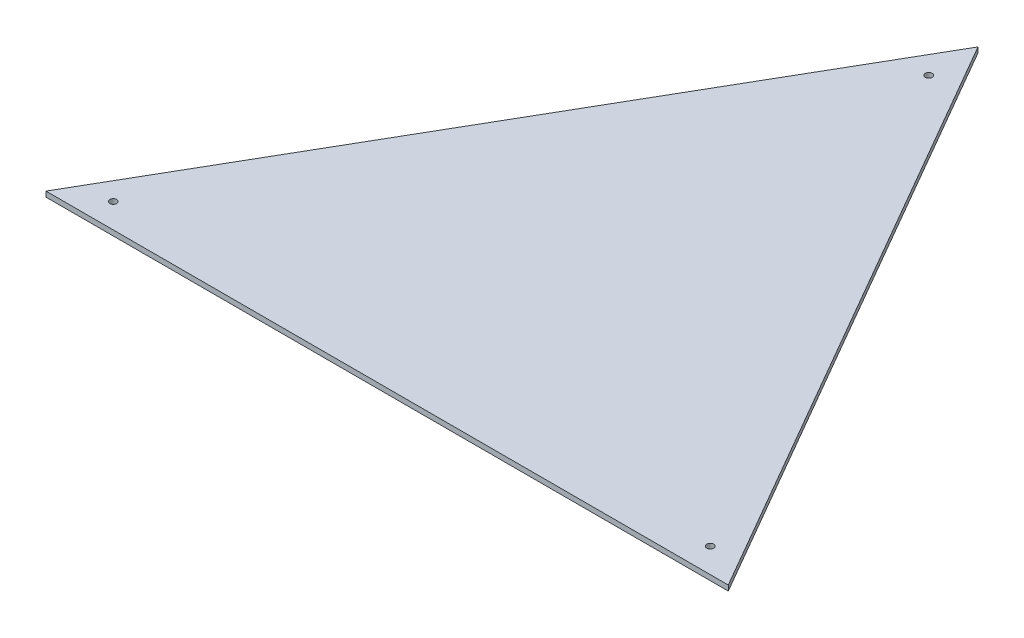
from build123d import *

# Parameters (mm, degrees)
BOSS_EXTRUDE1_DEPTH = 4.7625
SKETCH2_R           = 3.175
CUT_EXTRUDE1_DEPTH  = 471.43869038


with BuildPart() as part:
    # Sketch1 → Boss-Extrude1 (new body)
    with BuildSketch(Plane(origin=(0, 0, 0), x_dir=(1, 0, 0), z_dir=(0, 1, 0))):
        Polygon((0, 355.6), (-307.958633586, -177.8), (307.958633586, -177.8), align=None)
    extrude(amount=BOSS_EXTRUDE1_DEPTH)

    # Sketch2 → Cut-Extrude1 (cut, through all)
    with BuildSketch(Plane(origin=(0, 4.7625, 0), x_dir=(1, 0, 0), z_dir=(0, 1, 0))):
        with Locations(Location((0, 311.15, 0), (0, 0, 270))):
            Circle(SKETCH2_R)
        with Locations(Location((-269.463804388, -155.575, 0), (0, 0, 270))):
            Circle(SKETCH2_R)
        with Locations(Location((269.463804388, -155.575, 0), (0, 0, 270))):
            Circle(SKETCH2_R)
    extrude(amount=-CUT_EXTRUDE1_DEPTH, mode=Mode.SUBTRACT)


solid = part.part
